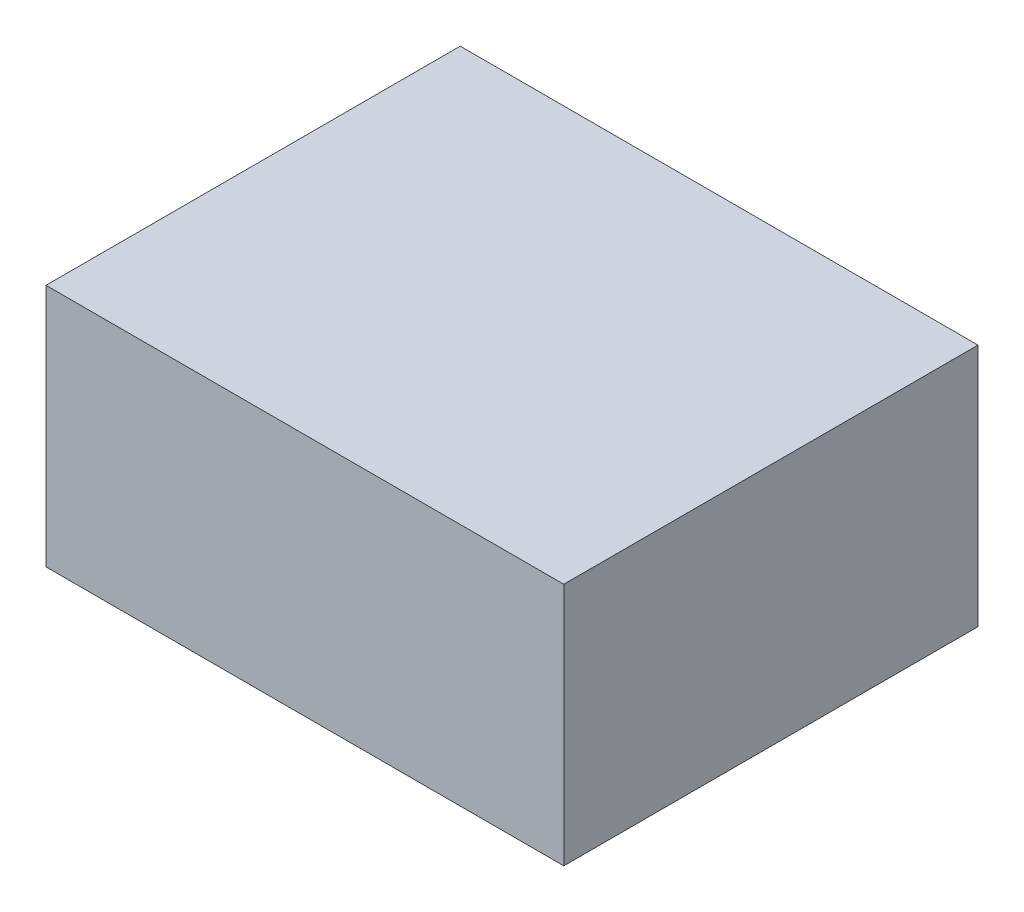
from build123d import *

# Parameters (mm, degrees)
SKETCH1_W           = 1016
SKETCH1_H           = 812.8
BOSS_EXTRUDE1_DEPTH = 478.536


with BuildPart() as part:
    # Sketch1 → Boss-Extrude1 (new body)
    with BuildSketch(Plane(origin=(0, 0, 0), x_dir=(1, 0, 0), z_dir=(0, 1, 0))):
        with Locations((508, 406.4)):
            Rectangle(SKETCH1_W, SKETCH1_H)
    extrude(amount=BOSS_EXTRUDE1_DEPTH)


solid = part.part
